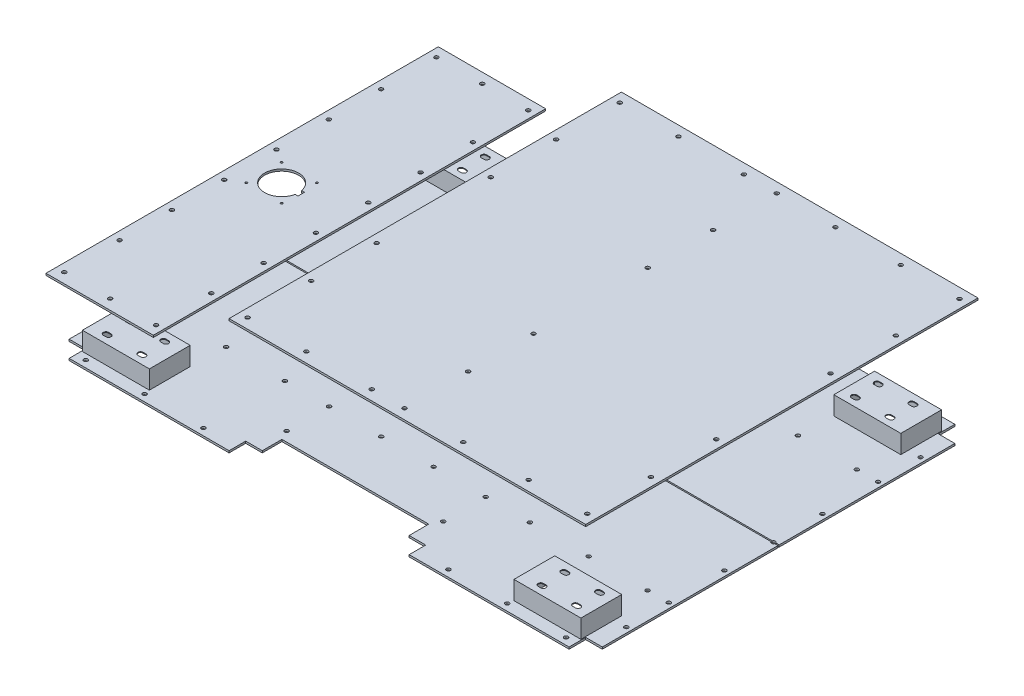
from build123d import *

# Parameters (mm, degrees)
SKETCH2_R             = 3
BOSS_EXTRUDE1_DEPTH   = 3
BOSS_EXTRUDE1_2_DEPTH = 3
SKETCH4_W             = 545.4
SKETCH4_H             = 600
SKETCH4_R             = 3
BOSS_EXTRUDE2_DEPTH   = 3
SKETCH6_R             = 3
BOSS_EXTRUDE3_DEPTH   = 3
CUT_EXTRUDE1_DEPTH    = 3
SKETCH10_R            = 1.6
CUT_EXTRUDE4_DEPTH    = 3
SKETCH13_W            = 100
SKETCH13_H            = 60
CUT_EXTRUDE6_DEPTH    = 3
BOSS_EXTRUDE4_START   = -3
SKETCH15_W            = 102.4
SKETCH15_H            = 62.4
SKETCH15_W_2          = 100
SKETCH15_H_2          = 60
BOSS_EXTRUDE4_DEPTH   = 27
SKETCH16_W            = 102.4
SKETCH16_H            = 62.4
BOSS_EXTRUDE5_DEPTH   = 1.2
CUT_EXTRUDE7_DEPTH    = 28.2
CUT_EXTRUDE8_DEPTH    = 1207.642215237
CUT_EXTRUDE9_DEPTH    = 1207.642215237
CUT_EXTRUDE10_DEPTH   = 1.2


with BuildPart() as part:
    # Sketch2 → Boss-Extrude1 (new body)
    with BuildSketch(Plane(origin=(0, 422.059491285, 0), x_dir=(1, 0, 0), z_dir=(0, 1, 0))):
        with BuildLine():
            Line((711.295088764, -928.695168064), (711.295088764, -660.095168064))
            Line((711.295088764, -660.095168064), (706.223515889, -660.095168064))
            ThreePointArc((706.223515889, -660.095168064), (703.395088764, -662.095168064), (700.56666164, -660.095168064))
            Line((700.56666164, -660.095168064), (426.223515889, -660.095168064))
            ThreePointArc((426.223515889, -660.095168064), (423.395088764, -662.095168064), (420.56666164, -660.095168064))
            Line((420.56666164, -660.095168064), (186.623515889, -660.095168064))
            ThreePointArc((186.623515889, -660.095168064), (183.795088764, -662.095168064), (180.96666164, -660.095168064))
            Line((180.96666164, -660.095168064), (-93.376484111, -660.095168064))
            ThreePointArc((-93.376484111, -660.095168064), (-96.204911236, -662.095168064), (-99.03333836, -660.095168064))
            Line((-99.03333836, -660.095168064), (-104.104911236, -660.095168064))
            Line((-104.104911236, -660.095168064), (-104.104911236, -928.695168064))
            Line((-104.104911236, -928.695168064), (-78.704911236, -928.695168064))
            Line((-78.704911236, -928.695168064), (-78.704911236, -954.095168064))
            Line((-78.704911236, -954.095168064), (165.895088764, -954.095168064))
            Line((165.895088764, -954.095168064), (165.895088764, -928.695168064))
            Line((165.895088764, -928.695168064), (191.295088764, -928.695168064))
            Line((191.295088764, -928.695168064), (191.295088764, -898.695168064))
            Line((191.295088764, -898.695168064), (415.895088764, -898.695168064))
            Line((415.895088764, -898.695168064), (415.895088764, -928.695168064))
            Line((415.895088764, -928.695168064), (441.295088764, -928.695168064))
            Line((441.295088764, -928.695168064), (441.295088764, -954.095168064))
            Line((441.295088764, -954.095168064), (685.895088764, -954.095168064))
            Line((685.895088764, -954.095168064), (685.895088764, -928.695168064))
            Line((685.895088764, -928.695168064), (711.295088764, -928.695168064))
        make_face()
        with Locations(Location((-63.704911236, -943.695168064, 0), (0, 0, 270))):
            Circle(SKETCH2_R, mode=Mode.SUBTRACT)
        with Locations(Location((-96.204911236, -884.095168064, 0), (0, 0, 270))):
            Circle(SKETCH2_R, mode=Mode.SUBTRACT)
        with Locations(Location((26.295088764, -943.695168064, 0), (0, 0, 270))):
            Circle(SKETCH2_R, mode=Mode.SUBTRACT)
        with Locations(Location((-96.204911236, -819.095168064, 0), (0, 0, 270))):
            Circle(SKETCH2_R, mode=Mode.SUBTRACT)
        with Locations(Location((-63.704911236, -819.095168064, 0), (0, 0, 270))):
            Circle(SKETCH2_R, mode=Mode.SUBTRACT)
        with Locations(Location((26.295088764, -819.095168064, 0), (0, 0, 270))):
            Circle(SKETCH2_R, mode=Mode.SUBTRACT)
        with Locations(Location((116.295088764, -943.695168064, 0), (0, 0, 270))):
            Circle(SKETCH2_R, mode=Mode.SUBTRACT)
        with Locations(Location((183.795088764, -884.095168064, 0), (0, 0, 270))):
            Circle(SKETCH2_R, mode=Mode.SUBTRACT)
        with Locations(Location((116.295088764, -819.095168064, 0), (0, 0, 270))):
            Circle(SKETCH2_R, mode=Mode.SUBTRACT)
        with Locations(Location((183.795088764, -819.095168064, 0), (0, 0, 270))):
            Circle(SKETCH2_R, mode=Mode.SUBTRACT)
        with Locations(Location((263.595088764, -819.095168064, 0), (0, 0, 270))):
            Circle(SKETCH2_R, mode=Mode.SUBTRACT)
        with Locations(Location((-96.204911236, -734.095168064, 0), (0, 0, 270))):
            Circle(SKETCH2_R, mode=Mode.SUBTRACT)
        with Locations(Location((183.795088764, -734.095168064, 0), (0, 0, 270))):
            Circle(SKETCH2_R, mode=Mode.SUBTRACT)
        with Locations(Location((490.895088764, -943.695168064, 0), (0, 0, 270))):
            Circle(SKETCH2_R, mode=Mode.SUBTRACT)
        with Locations(Location((423.395088764, -884.095168064, 0), (0, 0, 270))):
            Circle(SKETCH2_R, mode=Mode.SUBTRACT)
        with Locations(Location((343.595088764, -819.095168064, 0), (0, 0, 270))):
            Circle(SKETCH2_R, mode=Mode.SUBTRACT)
        with Locations(Location((423.395088764, -819.095168064, 0), (0, 0, 270))):
            Circle(SKETCH2_R, mode=Mode.SUBTRACT)
        with Locations(Location((490.895088764, -819.095168064, 0), (0, 0, 270))):
            Circle(SKETCH2_R, mode=Mode.SUBTRACT)
        with Locations(Location((580.895088764, -943.695168064, 0), (0, 0, 270))):
            Circle(SKETCH2_R, mode=Mode.SUBTRACT)
        with Locations(Location((670.895088764, -943.695168064, 0), (0, 0, 270))):
            Circle(SKETCH2_R, mode=Mode.SUBTRACT)
        with Locations(Location((703.395088764, -884.095168064, 0), (0, 0, 270))):
            Circle(SKETCH2_R, mode=Mode.SUBTRACT)
        with Locations(Location((580.895088764, -819.095168064, 0), (0, 0, 270))):
            Circle(SKETCH2_R, mode=Mode.SUBTRACT)
        with Locations(Location((670.895088764, -819.095168064, 0), (0, 0, 270))):
            Circle(SKETCH2_R, mode=Mode.SUBTRACT)
        with Locations(Location((703.395088764, -819.095168064, 0), (0, 0, 270))):
            Circle(SKETCH2_R, mode=Mode.SUBTRACT)
        with Locations(Location((423.395088764, -734.095168064, 0), (0, 0, 270))):
            Circle(SKETCH2_R, mode=Mode.SUBTRACT)
        with Locations(Location((703.395088764, -734.095168064, 0), (0, 0, 270))):
            Circle(SKETCH2_R, mode=Mode.SUBTRACT)
    extrude(amount=BOSS_EXTRUDE1_DEPTH)


with BuildPart() as body_2:
    # Sketch2 → Boss-Extrude1 2 (new body)
    with BuildSketch(Plane(origin=(0, 422.059491285, 0), x_dir=(1, 0, 0), z_dir=(0, 1, 0))):
        with BuildLine():
            Line((426.223515889, -658.095168064), (700.56666164, -658.095168064))
            ThreePointArc((700.56666164, -658.095168064), (703.395088764, -656.095168064), (706.223515889, -658.095168064))
            Line((706.223515889, -658.095168064), (711.295088764, -658.095168064))
            Line((711.295088764, -658.095168064), (711.295088764, -389.495168064))
            Line((711.295088764, -389.495168064), (685.895088764, -389.495168064))
            Line((685.895088764, -389.495168064), (685.895088764, -364.095168064))
            Line((685.895088764, -364.095168064), (441.295088764, -364.095168064))
            Line((441.295088764, -364.095168064), (441.295088764, -389.495168064))
            Line((441.295088764, -389.495168064), (415.895088764, -389.495168064))
            Line((415.895088764, -389.495168064), (415.895088764, -419.495168064))
            Line((415.895088764, -419.495168064), (191.295088764, -419.495168064))
            Line((191.295088764, -419.495168064), (191.295088764, -389.495168064))
            Line((191.295088764, -389.495168064), (165.895088764, -389.495168064))
            Line((165.895088764, -389.495168064), (165.895088764, -364.095168064))
            Line((165.895088764, -364.095168064), (-78.704911236, -364.095168064))
            Line((-78.704911236, -364.095168064), (-78.704911236, -389.495168064))
            Line((-78.704911236, -389.495168064), (-104.104911236, -389.495168064))
            Line((-104.104911236, -389.495168064), (-104.104911236, -658.095168064))
            Line((-104.104911236, -658.095168064), (-99.03333836, -658.095168064))
            ThreePointArc((-99.03333836, -658.095168064), (-96.204911236, -656.095168064), (-93.376484111, -658.095168064))
            Line((-93.376484111, -658.095168064), (180.96666164, -658.095168064))
            ThreePointArc((180.96666164, -658.095168064), (183.795088764, -656.095168064), (186.623515889, -658.095168064))
            Line((186.623515889, -658.095168064), (420.56666164, -658.095168064))
            ThreePointArc((420.56666164, -658.095168064), (423.395088764, -656.095168064), (426.223515889, -658.095168064))
        make_face()
        with Locations(Location((-96.204911236, -584.095168064, 0), (0, 0, 270))):
            Circle(SKETCH2_R, mode=Mode.SUBTRACT)
        with Locations(Location((183.795088764, -584.095168064, 0), (0, 0, 270))):
            Circle(SKETCH2_R, mode=Mode.SUBTRACT)
        with Locations(Location((-96.204911236, -499.095168064, 0), (0, 0, 270))):
            Circle(SKETCH2_R, mode=Mode.SUBTRACT)
        with Locations(Location((-63.704911236, -499.095168064, 0), (0, 0, 270))):
            Circle(SKETCH2_R, mode=Mode.SUBTRACT)
        with Locations(Location((26.295088764, -499.095168064, 0), (0, 0, 270))):
            Circle(SKETCH2_R, mode=Mode.SUBTRACT)
        with Locations(Location((-96.204911236, -434.095168064, 0), (0, 0, 270))):
            Circle(SKETCH2_R, mode=Mode.SUBTRACT)
        with Locations(Location((-63.704911236, -374.495168064, 0), (0, 0, 270))):
            Circle(SKETCH2_R, mode=Mode.SUBTRACT)
        with Locations(Location((26.295088764, -374.495168064, 0), (0, 0, 270))):
            Circle(SKETCH2_R, mode=Mode.SUBTRACT)
        with Locations(Location((116.295088764, -499.095168064, 0), (0, 0, 270))):
            Circle(SKETCH2_R, mode=Mode.SUBTRACT)
        with Locations(Location((183.795088764, -499.095168064, 0), (0, 0, 270))):
            Circle(SKETCH2_R, mode=Mode.SUBTRACT)
        with Locations(Location((263.595088764, -499.095168064, 0), (0, 0, 270))):
            Circle(SKETCH2_R, mode=Mode.SUBTRACT)
        with Locations(Location((183.795088764, -434.095168064, 0), (0, 0, 270))):
            Circle(SKETCH2_R, mode=Mode.SUBTRACT)
        with Locations(Location((116.295088764, -374.495168064, 0), (0, 0, 270))):
            Circle(SKETCH2_R, mode=Mode.SUBTRACT)
        with Locations(Location((423.395088764, -584.095168064, 0), (0, 0, 270))):
            Circle(SKETCH2_R, mode=Mode.SUBTRACT)
        with Locations(Location((703.395088764, -584.095168064, 0), (0, 0, 270))):
            Circle(SKETCH2_R, mode=Mode.SUBTRACT)
        with Locations(Location((343.595088764, -499.095168064, 0), (0, 0, 270))):
            Circle(SKETCH2_R, mode=Mode.SUBTRACT)
        with Locations(Location((423.395088764, -499.095168064, 0), (0, 0, 270))):
            Circle(SKETCH2_R, mode=Mode.SUBTRACT)
        with Locations(Location((490.895088764, -499.095168064, 0), (0, 0, 270))):
            Circle(SKETCH2_R, mode=Mode.SUBTRACT)
        with Locations(Location((423.395088764, -434.095168064, 0), (0, 0, 270))):
            Circle(SKETCH2_R, mode=Mode.SUBTRACT)
        with Locations(Location((490.895088764, -374.495168064, 0), (0, 0, 270))):
            Circle(SKETCH2_R, mode=Mode.SUBTRACT)
        with Locations(Location((580.895088764, -499.095168064, 0), (0, 0, 270))):
            Circle(SKETCH2_R, mode=Mode.SUBTRACT)
        with Locations(Location((670.895088764, -499.095168064, 0), (0, 0, 270))):
            Circle(SKETCH2_R, mode=Mode.SUBTRACT)
        with Locations(Location((703.395088764, -499.095168064, 0), (0, 0, 270))):
            Circle(SKETCH2_R, mode=Mode.SUBTRACT)
        with Locations(Location((580.895088764, -374.495168064, 0), (0, 0, 270))):
            Circle(SKETCH2_R, mode=Mode.SUBTRACT)
        with Locations(Location((703.395088764, -434.095168064, 0), (0, 0, 270))):
            Circle(SKETCH2_R, mode=Mode.SUBTRACT)
        with Locations(Location((670.895088764, -374.495168064, 0), (0, 0, 270))):
            Circle(SKETCH2_R, mode=Mode.SUBTRACT)
    extrude(amount=BOSS_EXTRUDE1_2_DEPTH)


with BuildPart() as body_3:
    # Sketch4 → Boss-Extrude2 (new body)
    with BuildSketch(Plane(origin=(0, 602.059491285, 0), x_dir=(1, 0, 0), z_dir=(0, 1, 0))):
        with Locations((443.595088764, -659.095168064)):
            Rectangle(SKETCH4_W, SKETCH4_H)
        with Locations(Location((423.795088764, -746.395168064, 0), (0, 0, 270))):
            Circle(SKETCH4_R, mode=Mode.SUBTRACT)
        with Locations(Location((183.795088764, -846.395168064, 0), (0, 0, 270))):
            Circle(SKETCH4_R, mode=Mode.SUBTRACT)
        with Locations(Location((183.795088764, -746.395168064, 0), (0, 0, 270))):
            Circle(SKETCH4_R, mode=Mode.SUBTRACT)
        with Locations(Location((183.795088764, -943.695168064, 0), (0, 0, 270))):
            Circle(SKETCH4_R, mode=Mode.SUBTRACT)
        with Locations(Location((273.595088764, -943.695168064, 0), (0, 0, 270))):
            Circle(SKETCH4_R, mode=Mode.SUBTRACT)
        with Locations(Location((373.595088764, -943.695168064, 0), (0, 0, 270))):
            Circle(SKETCH4_R, mode=Mode.SUBTRACT)
        with Locations(Location((423.795088764, -846.395168064, 0), (0, 0, 270))):
            Circle(SKETCH4_R, mode=Mode.SUBTRACT)
        with Locations(Location((423.795088764, -943.695168064, 0), (0, 0, 270))):
            Circle(SKETCH4_R, mode=Mode.SUBTRACT)
        with Locations(Location((703.395088764, -746.395168064, 0), (0, 0, 270))):
            Circle(SKETCH4_R, mode=Mode.SUBTRACT)
        with Locations(Location((703.395088764, -846.395168064, 0), (0, 0, 270))):
            Circle(SKETCH4_R, mode=Mode.SUBTRACT)
        with Locations(Location((513.595088764, -943.695168064, 0), (0, 0, 270))):
            Circle(SKETCH4_R, mode=Mode.SUBTRACT)
        with Locations(Location((703.395088764, -943.695168064, 0), (0, 0, 270))):
            Circle(SKETCH4_R, mode=Mode.SUBTRACT)
        with Locations(Location((613.595088764, -943.695168064, 0), (0, 0, 270))):
            Circle(SKETCH4_R, mode=Mode.SUBTRACT)
        with Locations(Location((613.595088764, -374.495168064, 0), (0, 0, 90))):
            Circle(SKETCH4_R, mode=Mode.SUBTRACT)
        with Locations(Location((703.395088764, -374.495168064, 0), (0, 0, 90))):
            Circle(SKETCH4_R, mode=Mode.SUBTRACT)
        with Locations(Location((513.595088764, -374.495168064, 0), (0, 0, 90))):
            Circle(SKETCH4_R, mode=Mode.SUBTRACT)
        with Locations(Location((703.395088764, -471.795168064, 0), (0, 0, 90))):
            Circle(SKETCH4_R, mode=Mode.SUBTRACT)
        with Locations(Location((703.395088764, -571.795168064, 0), (0, 0, 90))):
            Circle(SKETCH4_R, mode=Mode.SUBTRACT)
        with Locations(Location((423.795088764, -374.495168064, 0), (0, 0, 90))):
            Circle(SKETCH4_R, mode=Mode.SUBTRACT)
        with Locations(Location((423.795088764, -471.795168064, 0), (0, 0, 90))):
            Circle(SKETCH4_R, mode=Mode.SUBTRACT)
        with Locations(Location((373.595088764, -374.495168064, 0), (0, 0, 90))):
            Circle(SKETCH4_R, mode=Mode.SUBTRACT)
        with Locations(Location((273.595088764, -374.495168064, 0), (0, 0, 90))):
            Circle(SKETCH4_R, mode=Mode.SUBTRACT)
        with Locations(Location((183.795088764, -374.495168064, 0), (0, 0, 90))):
            Circle(SKETCH4_R, mode=Mode.SUBTRACT)
        with Locations(Location((183.795088764, -571.795168064, 0), (0, 0, 90))):
            Circle(SKETCH4_R, mode=Mode.SUBTRACT)
        with Locations(Location((183.795088764, -471.795168064, 0), (0, 0, 90))):
            Circle(SKETCH4_R, mode=Mode.SUBTRACT)
        with Locations(Location((423.795088764, -571.795168064, 0), (0, 0, 90))):
            Circle(SKETCH4_R, mode=Mode.SUBTRACT)
    extrude(amount=BOSS_EXTRUDE2_DEPTH)


with BuildPart() as body_4:
    # Sketch6 → Boss-Extrude3 (new body)
    with BuildSketch(Plane(origin=(0, 522.059491285, 0), x_dir=(1, 0, 0), z_dir=(0, 1, 0))):
        Polygon((-109.104911236, -959.095168064), (-109.104911236, -359.095168064), (55.095088764, -359.095168064), (55.095088764, -384.495168064), (55.095088764, -933.695168064), (55.095088764, -959.095168064), align=None)
        with Locations(Location((-96.604911236, -943.695168064, 0), (0, 0, 270))):
            Circle(SKETCH6_R, mode=Mode.SUBTRACT)
        with Locations(Location((-26.399911236, -943.695168064, 0), (0, 0, 270))):
            Circle(SKETCH6_R, mode=Mode.SUBTRACT)
        with Locations(Location((43.795088764, -943.695168064, 0), (0, 0, 270))):
            Circle(SKETCH6_R, mode=Mode.SUBTRACT)
        with Locations(Location((-96.604911236, -859.095168064, 0), (0, 0, 270))):
            Circle(SKETCH6_R, mode=Mode.SUBTRACT)
        with Locations(Location((43.795088764, -859.095168064, 0), (0, 0, 270))):
            Circle(SKETCH6_R, mode=Mode.SUBTRACT)
        with Locations(Location((43.795088764, -699.095168064, 0), (0, 0, 270))):
            Circle(SKETCH6_R, mode=Mode.SUBTRACT)
        with Locations(Location((-96.604911236, -699.095168064, 0), (0, 0, 270))):
            Circle(SKETCH6_R, mode=Mode.SUBTRACT)
        with Locations(Location((43.795088764, -779.095168064, 0), (0, 0, 270))):
            Circle(SKETCH6_R, mode=Mode.SUBTRACT)
        with Locations(Location((-96.604911236, -779.095168064, 0), (0, 0, 270))):
            Circle(SKETCH6_R, mode=Mode.SUBTRACT)
        with Locations(Location((-96.604911236, -619.095168064, 0), (0, 0, 90))):
            Circle(SKETCH6_R, mode=Mode.SUBTRACT)
        with Locations(Location((-96.604911236, -539.095168064, 0), (0, 0, 90))):
            Circle(SKETCH6_R, mode=Mode.SUBTRACT)
        with Locations(Location((43.795088764, -539.095168064, 0), (0, 0, 90))):
            Circle(SKETCH6_R, mode=Mode.SUBTRACT)
        with Locations(Location((43.795088764, -619.095168064, 0), (0, 0, 90))):
            Circle(SKETCH6_R, mode=Mode.SUBTRACT)
        with Locations(Location((43.795088764, -459.095168064, 0), (0, 0, 90))):
            Circle(SKETCH6_R, mode=Mode.SUBTRACT)
        with Locations(Location((-96.604911236, -459.095168064, 0), (0, 0, 90))):
            Circle(SKETCH6_R, mode=Mode.SUBTRACT)
        with Locations(Location((43.795088764, -374.495168064, 0), (0, 0, 90))):
            Circle(SKETCH6_R, mode=Mode.SUBTRACT)
        with Locations(Location((-26.399911236, -374.495168064, 0), (0, 0, 90))):
            Circle(SKETCH6_R, mode=Mode.SUBTRACT)
        with Locations(Location((-96.604911236, -374.495168064, 0), (0, 0, 90))):
            Circle(SKETCH6_R, mode=Mode.SUBTRACT)
    extrude(amount=BOSS_EXTRUDE3_DEPTH)

    # Sketch9 → Cut-Extrude1 (cut)
    with BuildSketch(Plane(origin=(0, 525.059491285, 0), x_dir=(1, 0, 0), z_dir=(0, 1, 0))):
        with BuildLine():
            Line((-23.190209591, -654.095168064), (-18.690209591, -654.095168064))
            Line((-18.690209591, -654.095168064), (-18.690209591, -664.095168064))
            Line((-18.690209591, -664.095168064), (-23.190209591, -664.095168064))
            ThreePointArc((-23.190209591, -664.095168064), (-74.704911236, -659.095168064), (-23.190209591, -654.095168064))
        make_face()
    extrude(amount=-CUT_EXTRUDE1_DEPTH, mode=Mode.SUBTRACT)

    # Sketch10 → Cut-Extrude4 (cut)
    with BuildSketch(Plane(origin=(0, 525.059491285, 0), x_dir=(1, 0, 0), z_dir=(0, 1, 0))):
        with Locations(Location((-21.704911236, -632.095168064, 0), (0, 0, 270))):
            Circle(SKETCH10_R)
        with Locations(Location((-21.704911236, -686.095168064, 0), (0, 0, 270))):
            Circle(SKETCH10_R)
        with Locations(Location((-75.704911236, -632.095168064, 0), (0, 0, 270))):
            Circle(SKETCH10_R)
        with Locations(Location((-75.704911236, -686.095168064, 0), (0, 0, 270))):
            Circle(SKETCH10_R)
    extrude(amount=-CUT_EXTRUDE4_DEPTH, mode=Mode.SUBTRACT)


with BuildPart() as cut_extrude6_tool:
    # Sketch13 → Cut-Extrude6 (new body)
    with BuildSketch(Plane.XZ.offset(-422.059491285)):
        with Locations((633.595088764, 903.695168064)):
            Rectangle(SKETCH13_W, SKETCH13_H)
        with Locations((633.595088764, 414.495168064)):
            Rectangle(SKETCH13_W, SKETCH13_H)
        with Locations((-26.404911236, 903.695168064)):
            Rectangle(SKETCH13_W, SKETCH13_H)
        with Locations((-26.404911236, 414.495168064)):
            Rectangle(SKETCH13_W, SKETCH13_H)
    extrude(amount=-CUT_EXTRUDE6_DEPTH)


with BuildPart() as part_1:
    add(part.part)

    # Cut-Extrude6: cut by cut_extrude6_tool
    add(cut_extrude6_tool.part, mode=Mode.SUBTRACT)



with BuildPart() as body_2_1:
    add(body_2.part)

    # Cut-Extrude6: cut by cut_extrude6_tool
    add(cut_extrude6_tool.part, mode=Mode.SUBTRACT)


with BuildPart() as part_2:
    add(part_1.part)

    add(body_2_1.part)  # Boss-Extrude4 merges body 2
    # Sketch15 → Boss-Extrude4 (add)
    # profile 1 of 4: a face of its own
    with BuildSketch(Plane.XZ.offset(-422.059491285).offset(BOSS_EXTRUDE4_START)):
        with Locations((633.595088764, 903.695168064)):
            Rectangle(SKETCH15_W, SKETCH15_H)
        with Locations((633.595088764, 903.695168064)):
            Rectangle(SKETCH15_W_2, SKETCH15_H_2, mode=Mode.SUBTRACT)
    # profile 2 of 4: a face of its own
    with BuildSketch(Plane.XZ.offset(-422.059491285).offset(BOSS_EXTRUDE4_START)):
        with Locations((633.595088764, 414.495168064)):
            Rectangle(SKETCH15_W, SKETCH15_H)
        with Locations((633.595088764, 414.495168064)):
            Rectangle(SKETCH15_W_2, SKETCH15_H_2, mode=Mode.SUBTRACT)
    # profile 3 of 4: a face of its own
    with BuildSketch(Plane.XZ.offset(-422.059491285).offset(BOSS_EXTRUDE4_START)):
        with Locations((-26.404911236, 414.495168064)):
            Rectangle(SKETCH15_W, SKETCH15_H)
        with Locations((-26.404911236, 414.495168064)):
            Rectangle(SKETCH15_W_2, SKETCH15_H_2, mode=Mode.SUBTRACT)
    # profile 4 of 4: a face of its own
    with BuildSketch(Plane.XZ.offset(-422.059491285).offset(BOSS_EXTRUDE4_START)):
        with Locations((-26.404911236, 903.695168064)):
            Rectangle(SKETCH15_W, SKETCH15_H)
        with Locations((-26.404911236, 903.695168064)):
            Rectangle(SKETCH15_W_2, SKETCH15_H_2, mode=Mode.SUBTRACT)
    extrude(amount=-BOSS_EXTRUDE4_DEPTH)

    # Sketch16 → Boss-Extrude5 (add)
    with BuildSketch(Plane(origin=(0, 452.059491285, 0), x_dir=(-1, 0, 0), z_dir=(0, 1, 0))):
        with Locations((-633.595088764, 903.695168064)):
            Rectangle(SKETCH16_W, SKETCH16_H)
        with Locations((-633.595088764, 414.495168064)):
            Rectangle(SKETCH16_W, SKETCH16_H)
        with Locations((26.404911236, 903.695168064)):
            Rectangle(SKETCH16_W, SKETCH16_H)
        with Locations((26.404911236, 414.495168064)):
            Rectangle(SKETCH16_W, SKETCH16_H)
    extrude(amount=BOSS_EXTRUDE5_DEPTH)

    # Sketch18 → Cut-Extrude7 (cut)
    with BuildSketch(Plane(origin=(0, 453.259491285, 0), x_dir=(1, 0, 0), z_dir=(0, 1, 0))):
        with BuildLine():
            Line((657.095088764, -401.495168064), (653.095088764, -401.495168064))
            ThreePointArc((653.095088764, -401.495168064), (649.095088764, -397.495168064), (653.095088764, -393.495168064))
            Line((653.095088764, -393.495168064), (657.095088764, -393.495168064))
            ThreePointArc((657.095088764, -393.495168064), (661.095088764, -397.495168064), (657.095088764, -401.495168064))
        make_face()
        with BuildLine():
            Line((604.095088764, -393.495168064), (600.095088764, -393.495168064))
            ThreePointArc((600.095088764, -393.495168064), (596.095088764, -397.495168064), (600.095088764, -401.495168064))
            Line((600.095088764, -401.495168064), (604.095088764, -401.495168064))
            ThreePointArc((604.095088764, -401.495168064), (608.095088764, -397.495168064), (604.095088764, -393.495168064))
        make_face()
        with BuildLine():
            Line((653.095088764, -428.495168064), (657.095088764, -428.495168064))
            ThreePointArc((657.095088764, -428.495168064), (661.095088764, -432.495168064), (657.095088764, -436.495168064))
            Line((657.095088764, -436.495168064), (653.095088764, -436.495168064))
            ThreePointArc((653.095088764, -436.495168064), (649.095088764, -432.495168064), (653.095088764, -428.495168064))
        make_face()
        with BuildLine():
            Line((600.095088764, -436.495168064), (604.095088764, -436.495168064))
            ThreePointArc((604.095088764, -436.495168064), (608.095088764, -432.495168064), (604.095088764, -428.495168064))
            Line((604.095088764, -428.495168064), (600.095088764, -428.495168064))
            ThreePointArc((600.095088764, -428.495168064), (596.095088764, -432.495168064), (600.095088764, -436.495168064))
        make_face()
    extrude(amount=-CUT_EXTRUDE7_DEPTH, mode=Mode.SUBTRACT)

    # Sketch19 → Cut-Extrude8 (cut, through all)
    with BuildSketch(Plane(origin=(0, 453.259491285, 0), x_dir=(1, 0, 0), z_dir=(0, 1, 0))):
        with BuildLine():
            Line((614.095088764, -882.695168064), (610.095088764, -882.695168064))
            ThreePointArc((610.095088764, -882.695168064), (606.095088764, -886.695168064), (610.095088764, -890.695168064))
            Line((610.095088764, -890.695168064), (614.095088764, -890.695168064))
            ThreePointArc((614.095088764, -890.695168064), (618.095088764, -886.695168064), (614.095088764, -882.695168064))
        make_face()
        with BuildLine():
            Line((663.095088764, -882.695168064), (667.095088764, -882.695168064))
            ThreePointArc((667.095088764, -882.695168064), (671.095088764, -886.695168064), (667.095088764, -890.695168064))
            Line((667.095088764, -890.695168064), (663.095088764, -890.695168064))
            ThreePointArc((663.095088764, -890.695168064), (659.095088764, -886.695168064), (663.095088764, -882.695168064))
        make_face()
        with BuildLine():
            Line((614.095088764, -917.695168064), (610.095088764, -917.695168064))
            ThreePointArc((610.095088764, -917.695168064), (606.095088764, -921.695168064), (610.095088764, -925.695168064))
            Line((610.095088764, -925.695168064), (614.095088764, -925.695168064))
            ThreePointArc((614.095088764, -925.695168064), (618.095088764, -921.695168064), (614.095088764, -917.695168064))
        make_face()
        with BuildLine():
            Line((663.095088764, -917.695168064), (667.095088764, -917.695168064))
            ThreePointArc((667.095088764, -917.695168064), (671.095088764, -921.695168064), (667.095088764, -925.695168064))
            Line((667.095088764, -925.695168064), (663.095088764, -925.695168064))
            ThreePointArc((663.095088764, -925.695168064), (659.095088764, -921.695168064), (663.095088764, -917.695168064))
        make_face()
    extrude(amount=-CUT_EXTRUDE8_DEPTH, mode=Mode.SUBTRACT)

    # Sketch21 → Cut-Extrude9 (cut, through all)
    with BuildSketch(Plane(origin=(0, 453.259491285, 0), x_dir=(1, 0, 0), z_dir=(0, 1, 0))):
        with BuildLine():
            Line((-50.904911236, -917.695168064), (-54.904911236, -917.695168064))
            ThreePointArc((-54.904911236, -917.695168064), (-58.904911236, -921.695168064), (-54.904911236, -925.695168064))
            Line((-54.904911236, -925.695168064), (-50.904911236, -925.695168064))
            ThreePointArc((-50.904911236, -925.695168064), (-46.904911236, -921.695168064), (-50.904911236, -917.695168064))
        make_face()
        with BuildLine():
            Line((-50.904911236, -882.695168064), (-54.904911236, -882.695168064))
            ThreePointArc((-54.904911236, -882.695168064), (-58.904911236, -886.695168064), (-54.904911236, -890.695168064))
            Line((-54.904911236, -890.695168064), (-50.904911236, -890.695168064))
            ThreePointArc((-50.904911236, -890.695168064), (-46.904911236, -886.695168064), (-50.904911236, -882.695168064))
        make_face()
        with BuildLine():
            Line((-1.904911236, -882.695168064), (2.095088764, -882.695168064))
            ThreePointArc((2.095088764, -882.695168064), (6.095088764, -886.695168064), (2.095088764, -890.695168064))
            Line((2.095088764, -890.695168064), (-1.904911236, -890.695168064))
            ThreePointArc((-1.904911236, -890.695168064), (-5.904911236, -886.695168064), (-1.904911236, -882.695168064))
        make_face()
        with BuildLine():
            Line((-1.904911236, -917.695168064), (2.095088764, -917.695168064))
            ThreePointArc((2.095088764, -917.695168064), (6.095088764, -921.695168064), (2.095088764, -925.695168064))
            Line((2.095088764, -925.695168064), (-1.904911236, -925.695168064))
            ThreePointArc((-1.904911236, -925.695168064), (-5.904911236, -921.695168064), (-1.904911236, -917.695168064))
        make_face()
    extrude(amount=-CUT_EXTRUDE9_DEPTH, mode=Mode.SUBTRACT)

    # Sketch22 → Cut-Extrude10 (cut)
    with BuildSketch(Plane(origin=(0, 453.259491285, 0), x_dir=(1, 0, 0), z_dir=(0, 1, 0))):
        with BuildLine():
            Line((-49.904911236, -428.495168064), (-53.904911236, -428.495168064))
            ThreePointArc((-53.904911236, -428.495168064), (-57.904911236, -432.495168064), (-53.904911236, -436.495168064))
            Line((-53.904911236, -436.495168064), (-49.904911236, -436.495168064))
            ThreePointArc((-49.904911236, -436.495168064), (-45.904911236, -432.495168064), (-49.904911236, -428.495168064))
        make_face()
        with BuildLine():
            Line((-53.904911236, -401.495168064), (-49.904911236, -401.495168064))
            ThreePointArc((-49.904911236, -401.495168064), (-45.904911236, -397.495168064), (-49.904911236, -393.495168064))
            Line((-49.904911236, -393.495168064), (-53.904911236, -393.495168064))
            ThreePointArc((-53.904911236, -393.495168064), (-57.904911236, -397.495168064), (-53.904911236, -401.495168064))
        make_face()
        with BuildLine():
            Line((-0.904911236, -428.495168064), (3.095088764, -428.495168064))
            ThreePointArc((3.095088764, -428.495168064), (7.095088764, -432.495168064), (3.095088764, -436.495168064))
            Line((3.095088764, -436.495168064), (-0.904911236, -436.495168064))
            ThreePointArc((-0.904911236, -436.495168064), (-4.904911236, -432.495168064), (-0.904911236, -428.495168064))
        make_face()
        with BuildLine():
            Line((3.095088764, -401.495168064), (-0.904911236, -401.495168064))
            ThreePointArc((-0.904911236, -401.495168064), (-4.904911236, -397.495168064), (-0.904911236, -393.495168064))
            Line((-0.904911236, -393.495168064), (3.095088764, -393.495168064))
            ThreePointArc((3.095088764, -393.495168064), (7.095088764, -397.495168064), (3.095088764, -401.495168064))
        make_face()
    extrude(amount=-CUT_EXTRUDE10_DEPTH, mode=Mode.SUBTRACT)


solid = Compound([body_3.part, body_4.part, part_2.part])
